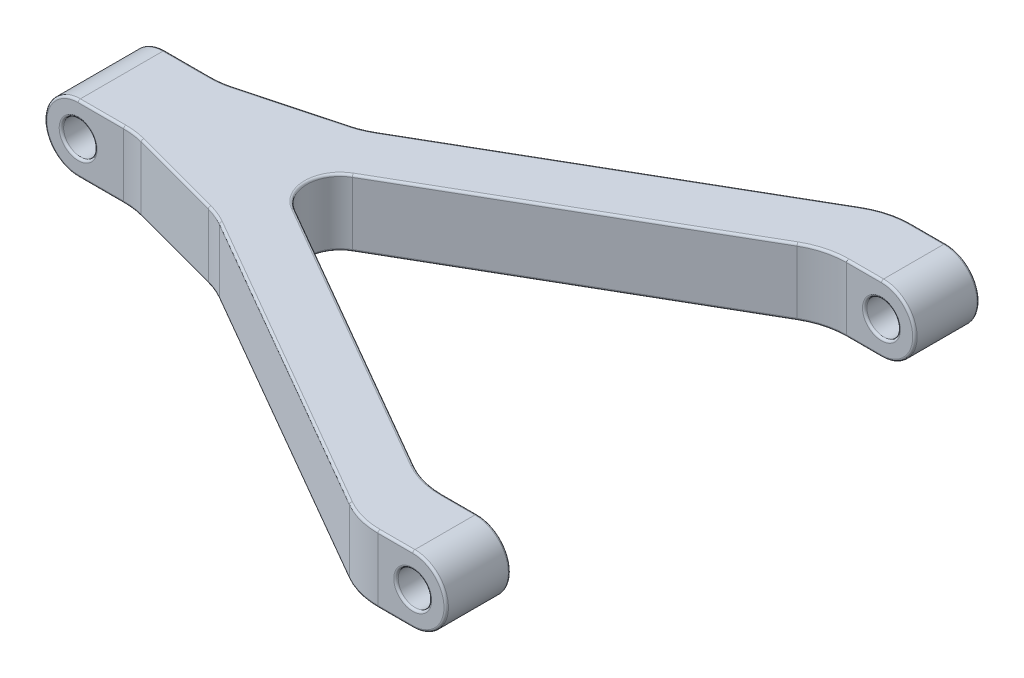
from build123d import *

# Parameters (mm, degrees)
BOSS_EXTRUDE1_DEPTH     = 60
BOSS_EXTRUDE2_START     = -39
BOSS_EXTRUDE2_DEPTH     = 78
CUT_EXTRUDE1_DEPTH      = 460.607861331
CUT_EXTRUDE1_DEPTH_BACK = 460.607861331
SKETCH3_R               = 15
SKETCH5_R               = 30
BOSS_EXTRUDE4_DEPTH     = 57.74
CUT_EXTRUDE2_START      = -77.47
SKETCH6_R               = 15
CUT_EXTRUDE2_DEPTH      = 698.955490231
CUT_EXTRUDE3_DEPTH      = 621.485490231
CUT_EXTRUDE3_DEPTH_BACK = 621.485490231
SKETCH7_R               = 15
FILLET1_R               = 70
FILLET18_R              = 2


with BuildPart() as part:
    # Sketch1 → Boss-Extrude1 (new body)
    with BuildSketch(Plane(origin=(0, 0, 0), x_dir=(1, 0, 0), z_dir=(0, 1, 0))):
        with BuildLine():
            Line((-138.952376829, -39), (-138.952376829, 39))
            Line((-138.952376829, 39), (-88.952376829, 39))
            Line((-88.952376829, 39), (11.047623171, 65.794919243))
            Line((11.047623171, 65.794919243), (311.047623171, 239))
            Line((311.047623171, 239), (361.047623171, 239))
            Line((361.047623171, 239), (361.047623171, 181.26))
            Line((361.047623171, 181.26), (311.039009542, 181.26))
            Line((311.039009542, 181.26), (42.087480162, 25.980762114))
            ThreePointArc((42.087480162, 25.980762114), (27.087480162, 0), (42.087480162, -25.980762114))
            Line((42.087480162, -25.980762114), (311.039009542, -181.26))
            Line((311.039009542, -181.26), (361.047623171, -181.26))
            Line((361.047623171, -181.26), (361.047623171, -239))
            Line((361.047623171, -239), (311.047623171, -239))
            Line((311.047623171, -239), (11.047623171, -65.794919243))
            Line((11.047623171, -65.794919243), (-88.952376829, -39))
            Line((-88.952376829, -39), (-138.952376829, -39))
        make_face()
    boss_extrude1 = extrude(amount=BOSS_EXTRUDE1_DEPTH)

    # Sketch2 → Boss-Extrude2 (add)
    with BuildSketch(Plane.XY.offset(BOSS_EXTRUDE2_START)):
        with BuildLine():
            Line((-138.952376829, 60), (-138.952376829, 0))
            ThreePointArc((-138.952376829, 0), (-168.952376829, 30), (-138.952376829, 60))
        make_face()
    extrude(amount=BOSS_EXTRUDE2_DEPTH)

    # Sketch3 → Cut-Extrude1 (cut, two sides: drawn at the far end of the back side and taken through both)
    with BuildSketch(Plane.XY.offset(39).offset(-CUT_EXTRUDE1_DEPTH_BACK)):
        with Locations((-138.952376829, 30)):
            Circle(SKETCH3_R)
    extrude(amount=CUT_EXTRUDE1_DEPTH + CUT_EXTRUDE1_DEPTH_BACK, mode=Mode.SUBTRACT)

    # Sketch5 → Boss-Extrude4 (add)
    with BuildSketch(Plane.XY.offset(239)):
        with Locations((361.047623171, 30)):
            Circle(SKETCH5_R)
    boss_extrude4 = extrude(amount=-BOSS_EXTRUDE4_DEPTH)

    # Sketch6 → Cut-Extrude2 (cut)
    with BuildSketch(Plane.XY.offset(239).offset(CUT_EXTRUDE2_START)):
        with Locations(Location((361.047623171, 30, 0), (0, 0, 180))):
            Circle(SKETCH6_R)
    cut_extrude2 = extrude(amount=CUT_EXTRUDE2_DEPTH, mode=Mode.SUBTRACT)

    # Mirror2: Boss-Extrude1, Boss-Extrude4, Cut-Extrude2 across plane
    add(boss_extrude1.mirror(Plane.XY))
    add(boss_extrude4.mirror(Plane.XY))
    add(cut_extrude2.mirror(Plane.XY), mode=Mode.SUBTRACT)

    # Sketch7 → Cut-Extrude3 (cut, two sides: drawn at the far end of the back side and taken through both)
    with BuildSketch(Plane.XY.offset(239).offset(-CUT_EXTRUDE3_DEPTH_BACK)):
        with Locations(Location((361.047623171, 30, 0), (0, 0, 180))):
            Circle(SKETCH7_R)
        with Locations((-138.952376829, 30)):
            Circle(SKETCH7_R)
    extrude(amount=CUT_EXTRUDE3_DEPTH + CUT_EXTRUDE3_DEPTH_BACK, mode=Mode.SUBTRACT)

    # Fillet1
    fillet1_edges = [part.edges().sort_by_distance(p)[0] for p in [
        (311.039009542, 30, -181.26),
        (311.039009542, 30, 181.26),
        (311.047623171, 30, 239),
        (11.047623171, 30, 65.794919243),
        (-88.952376829, 30, 39),
        (-88.952376829, 30, -39),
        (11.047623171, 30, -65.794919243),
        (311.047623171, 30, -239),
    ]]
    fillet(fillet1_edges, radius=FILLET1_R)

    # Fillet18
    fillet18_edges = [part.edges().sort_by_distance(p)[0] for p in [
        (391.047623171, 30, -239),
        (391.047623171, 30, -181.26),
        (376.047623171, 30, -181.26),
        (376.047623171, 30, -239),
        (168.441466587, 0, -98.931270189),
        (27.087480162, 0, 0),
        (-118.560214245, 60, -39),
        (-118.560214245, 0, -39),
        (-38.952376829, 0, -52.397459622),
        (-38.952376829, 60, -52.397459622),
        (156.916349164, 0, -150.012267462),
        (156.916349164, 60, -150.012267462),
        (345.421538091, 0, 181.26),
        (345.421538091, 0, -181.26),
        (345.421538091, 60, -181.26),
        (168.441466587, 0, 98.931270189),
        (345.425844906, 0, 239),
        (156.916349164, 0, 150.012267462),
        (-38.952376829, 0, 52.397459622),
        (311.686733484, 0, 236.61480784),
        (311.686733484, 0, -236.61480784),
        (-38.952376829, 60, 52.397459622),
        (156.916349164, 60, 150.012267462),
        (345.425844906, 60, 239),
        (168.441466587, 60, 98.931270189),
        (311.686733484, 60, 236.61480784),
        (311.686733484, 60, -236.61480784),
        (-89.031218205, 0, -39.598859704),
        (-89.031218205, 60, -39.598859704),
        (10.816471953, 0, -66.352967648),
        (10.816471953, 60, -66.352967648),
        (311.678119855, 0, -178.87480784),
        (-118.560214245, 0, 39),
        (311.678119855, 60, -178.87480784),
        (311.678119855, 0, 178.87480784),
        (311.678119855, 60, 178.87480784),
        (10.816471953, 0, 66.352967648),
        (10.816471953, 60, 66.352967648),
        (-89.031218205, 0, 39.598859704),
        (-89.031218205, 60, 39.598859704),
        (345.425844906, 0, -239),
        (-118.560214245, 60, 39),
        (345.421538091, 60, 181.26),
        (-168.952376829, 30, -39),
        (-168.952376829, 30, 39),
        (345.425844906, 60, -239),
        (27.087480162, 60, 0),
        (-153.952376829, 30, -39),
        (168.441466587, 60, -98.931270189),
        (391.047623171, 30, 239),
        (391.047623171, 30, 181.26),
        (376.047623171, 30, 239),
        (-153.952376829, 30, 39),
    ]]
    fillet(fillet18_edges, radius=FILLET18_R)


solid = part.part
